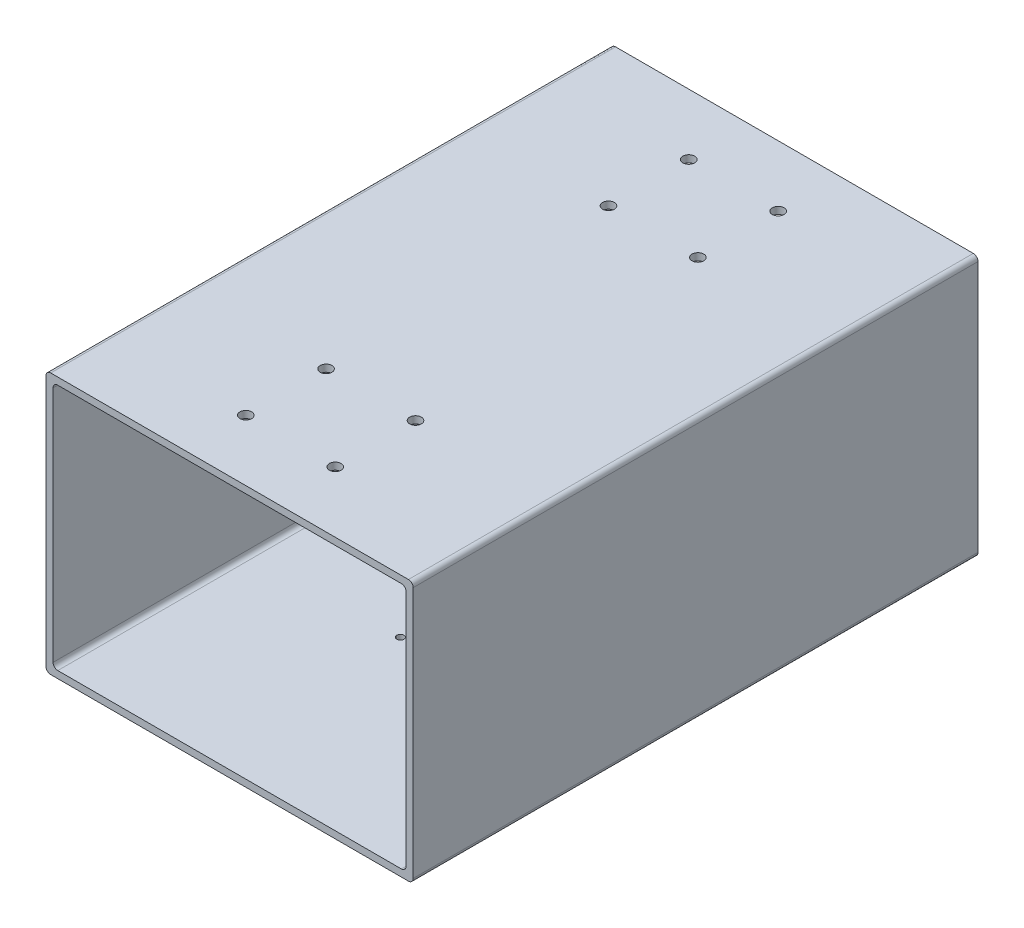
from build123d import *

# Parameters (mm, degrees)
SKETCH1_W                      = 156
SKETCH1_H                      = 111
SKETCH1_W_2                    = 150
SKETCH1_H_2                    = 105
EXTRUDE_THIN1_DEPTH            = 120
FILLET1_R                      = 2
CUT_EXTRUDE1_REACH             = 183.122
SKETCH5_R                      = 2.5
CUT_EXTRUDE1_DIRECTION_2_DEPTH = 182.121506177
CUT_EXTRUDE2_REACH             = 183.122
SKETCH7_R                      = 1.5
CUT_EXTRUDE2_DIRECTION_2_DEPTH = 182.121506177


with BuildPart() as part:
    # Sketch1 → Extrude-Thin1 (new, symmetric)
    with BuildSketch(Plane.XY):
        Rectangle(SKETCH1_W, SKETCH1_H)
        Rectangle(SKETCH1_W_2, SKETCH1_H_2, mode=Mode.SUBTRACT)
    extrude(amount=EXTRUDE_THIN1_DEPTH, both=True)

    # Fillet1
    fillet1_edges = [part.edges().sort_by_distance(p)[0] for p in [
        (-75, 52.5, 0),
        (-75, -52.5, 0),
        (75, -52.5, 0),
        (75, 52.5, 0),
        (-78, 55.5, 0),
        (78, 55.5, 0),
        (78, -55.5, 0),
        (-78, -55.5, 0),
    ]]
    fillet(fillet1_edges, radius=FILLET1_R)

    # Sketch5 → Cut-Extrude1 (cut, up to next)
    with BuildSketch(Plane(origin=(0, 55.5, 0), x_dir=(1, 0, 0), z_dir=(0, 1, 0)), mode=Mode.PRIVATE) as cut_extrude1_sk1:
        with Locations((-19, 60)):
            Circle(SKETCH5_R)
    cut_extrude1_tool1 = extrude(cut_extrude1_sk1.sketch, amount=-CUT_EXTRUDE1_REACH, mode=Mode.PRIVATE) & part.part
    # Sketch5 → Cut-Extrude1 (cut, up to next)
    with BuildSketch(Plane(origin=(0, 55.5, 0), x_dir=(1, 0, 0), z_dir=(0, 1, 0)), mode=Mode.PRIVATE) as cut_extrude1_sk2:
        with Locations((19, 60)):
            Circle(SKETCH5_R)
    cut_extrude1_tool2 = extrude(cut_extrude1_sk2.sketch, amount=-CUT_EXTRUDE1_REACH, mode=Mode.PRIVATE) & part.part
    # Sketch5 → Cut-Extrude1 (cut, up to next)
    with BuildSketch(Plane(origin=(0, 55.5, 0), x_dir=(1, 0, 0), z_dir=(0, 1, 0)), mode=Mode.PRIVATE) as cut_extrude1_sk3:
        with Locations((19, -60)):
            Circle(SKETCH5_R)
    cut_extrude1_tool3 = extrude(cut_extrude1_sk3.sketch, amount=-CUT_EXTRUDE1_REACH, mode=Mode.PRIVATE) & part.part
    # Sketch5 → Cut-Extrude1 (cut, up to next)
    with BuildSketch(Plane(origin=(0, 55.5, 0), x_dir=(1, 0, 0), z_dir=(0, 1, 0)), mode=Mode.PRIVATE) as cut_extrude1_sk4:
        with Locations((-19, -60)):
            Circle(SKETCH5_R)
    cut_extrude1_tool4 = extrude(cut_extrude1_sk4.sketch, amount=-CUT_EXTRUDE1_REACH, mode=Mode.PRIVATE) & part.part
    # Sketch5 → Cut-Extrude1 (cut, up to next)
    with BuildSketch(Plane(origin=(0, 55.5, 0), x_dir=(1, 0, 0), z_dir=(0, 1, 0)), mode=Mode.PRIVATE) as cut_extrude1_sk5:
        with Locations((-19, 94.1)):
            Circle(SKETCH5_R)
    cut_extrude1_tool5 = extrude(cut_extrude1_sk5.sketch, amount=-CUT_EXTRUDE1_REACH, mode=Mode.PRIVATE) & part.part
    # Sketch5 → Cut-Extrude1 (cut, up to next)
    with BuildSketch(Plane(origin=(0, 55.5, 0), x_dir=(1, 0, 0), z_dir=(0, 1, 0)), mode=Mode.PRIVATE) as cut_extrude1_sk6:
        with Locations((19, 94.1)):
            Circle(SKETCH5_R)
    cut_extrude1_tool6 = extrude(cut_extrude1_sk6.sketch, amount=-CUT_EXTRUDE1_REACH, mode=Mode.PRIVATE) & part.part
    # Sketch5 → Cut-Extrude1 (cut, up to next)
    with BuildSketch(Plane(origin=(0, 55.5, 0), x_dir=(1, 0, 0), z_dir=(0, 1, 0)), mode=Mode.PRIVATE) as cut_extrude1_sk7:
        with Locations((19, -94.1)):
            Circle(SKETCH5_R)
    cut_extrude1_tool7 = extrude(cut_extrude1_sk7.sketch, amount=-CUT_EXTRUDE1_REACH, mode=Mode.PRIVATE) & part.part
    # Sketch5 → Cut-Extrude1 (cut, up to next)
    with BuildSketch(Plane(origin=(0, 55.5, 0), x_dir=(1, 0, 0), z_dir=(0, 1, 0)), mode=Mode.PRIVATE) as cut_extrude1_sk8:
        with Locations((-19, -94.1)):
            Circle(SKETCH5_R)
    cut_extrude1_tool8 = extrude(cut_extrude1_sk8.sketch, amount=-CUT_EXTRUDE1_REACH, mode=Mode.PRIVATE) & part.part
    add(cut_extrude1_tool1.solids().sort_by_distance((-19, 55.5, -60))[0], mode=Mode.SUBTRACT)
    add(cut_extrude1_tool2.solids().sort_by_distance((19, 55.5, -60))[0], mode=Mode.SUBTRACT)
    add(cut_extrude1_tool3.solids().sort_by_distance((19, 55.5, 60))[0], mode=Mode.SUBTRACT)
    add(cut_extrude1_tool4.solids().sort_by_distance((-19, 55.5, 60))[0], mode=Mode.SUBTRACT)
    add(cut_extrude1_tool5.solids().sort_by_distance((-19, 55.5, -94.1))[0], mode=Mode.SUBTRACT)
    add(cut_extrude1_tool6.solids().sort_by_distance((19, 55.5, -94.1))[0], mode=Mode.SUBTRACT)
    add(cut_extrude1_tool7.solids().sort_by_distance((19, 55.5, 94.1))[0], mode=Mode.SUBTRACT)
    add(cut_extrude1_tool8.solids().sort_by_distance((-19, 55.5, 94.1))[0], mode=Mode.SUBTRACT)

    # Sketch5 → Cut-Extrude1 direction 2 (cut)
    with BuildSketch(Plane(origin=(0, 55.5, 0), x_dir=(1, 0, 0), z_dir=(0, 1, 0))):
        with Locations((-19, 60)):
            Circle(SKETCH5_R)
        with Locations((19, 60)):
            Circle(SKETCH5_R)
        with Locations((19, -60)):
            Circle(SKETCH5_R)
        with Locations((-19, -60)):
            Circle(SKETCH5_R)
        with Locations((-19, 94.1)):
            Circle(SKETCH5_R)
        with Locations((19, 94.1)):
            Circle(SKETCH5_R)
        with Locations((19, -94.1)):
            Circle(SKETCH5_R)
        with Locations((-19, -94.1)):
            Circle(SKETCH5_R)
    extrude(amount=CUT_EXTRUDE1_DIRECTION_2_DEPTH, mode=Mode.SUBTRACT)

    # Sketch7 → Cut-Extrude2 (cut, up to next)
    with BuildSketch(Plane(origin=(0, -55.5, 0), x_dir=(-1, 0, 0), z_dir=(0, -1, 0)), mode=Mode.PRIVATE) as cut_extrude2_sk1:
        with Locations((-12.475, -34.95)):
            Circle(SKETCH7_R)
    cut_extrude2_tool1 = extrude(cut_extrude2_sk1.sketch, amount=-CUT_EXTRUDE2_REACH, mode=Mode.PRIVATE) & part.part
    # Sketch7 → Cut-Extrude2 (cut, up to next)
    with BuildSketch(Plane(origin=(0, -55.5, 0), x_dir=(-1, 0, 0), z_dir=(0, -1, 0)), mode=Mode.PRIVATE) as cut_extrude2_sk2:
        with Locations((12.475, -34.95)):
            Circle(SKETCH7_R)
    cut_extrude2_tool2 = extrude(cut_extrude2_sk2.sketch, amount=-CUT_EXTRUDE2_REACH, mode=Mode.PRIVATE) & part.part
    # Sketch7 → Cut-Extrude2 (cut, up to next)
    with BuildSketch(Plane(origin=(0, -55.5, 0), x_dir=(-1, 0, 0), z_dir=(0, -1, 0)), mode=Mode.PRIVATE) as cut_extrude2_sk3:
        with Locations((-12.475, 34.95)):
            Circle(SKETCH7_R)
    cut_extrude2_tool3 = extrude(cut_extrude2_sk3.sketch, amount=-CUT_EXTRUDE2_REACH, mode=Mode.PRIVATE) & part.part
    # Sketch7 → Cut-Extrude2 (cut, up to next)
    with BuildSketch(Plane(origin=(0, -55.5, 0), x_dir=(-1, 0, 0), z_dir=(0, -1, 0)), mode=Mode.PRIVATE) as cut_extrude2_sk4:
        with Locations((12.475, 34.95)):
            Circle(SKETCH7_R)
    cut_extrude2_tool4 = extrude(cut_extrude2_sk4.sketch, amount=-CUT_EXTRUDE2_REACH, mode=Mode.PRIVATE) & part.part
    add(cut_extrude2_tool1.solids().sort_by_distance((12.475, -55.5, 34.95))[0], mode=Mode.SUBTRACT)
    add(cut_extrude2_tool2.solids().sort_by_distance((-12.475, -55.5, 34.95))[0], mode=Mode.SUBTRACT)
    add(cut_extrude2_tool3.solids().sort_by_distance((12.475, -55.5, -34.95))[0], mode=Mode.SUBTRACT)
    add(cut_extrude2_tool4.solids().sort_by_distance((-12.475, -55.5, -34.95))[0], mode=Mode.SUBTRACT)

    # Sketch7 → Cut-Extrude2 direction 2 (cut)
    with BuildSketch(Plane(origin=(0, -55.5, 0), x_dir=(-1, 0, 0), z_dir=(0, -1, 0))):
        with Locations((-12.475, -34.95)):
            Circle(SKETCH7_R)
        with Locations((12.475, -34.95)):
            Circle(SKETCH7_R)
        with Locations((-12.475, 34.95)):
            Circle(SKETCH7_R)
        with Locations((12.475, 34.95)):
            Circle(SKETCH7_R)
    extrude(amount=CUT_EXTRUDE2_DIRECTION_2_DEPTH, mode=Mode.SUBTRACT)


solid = part.part
